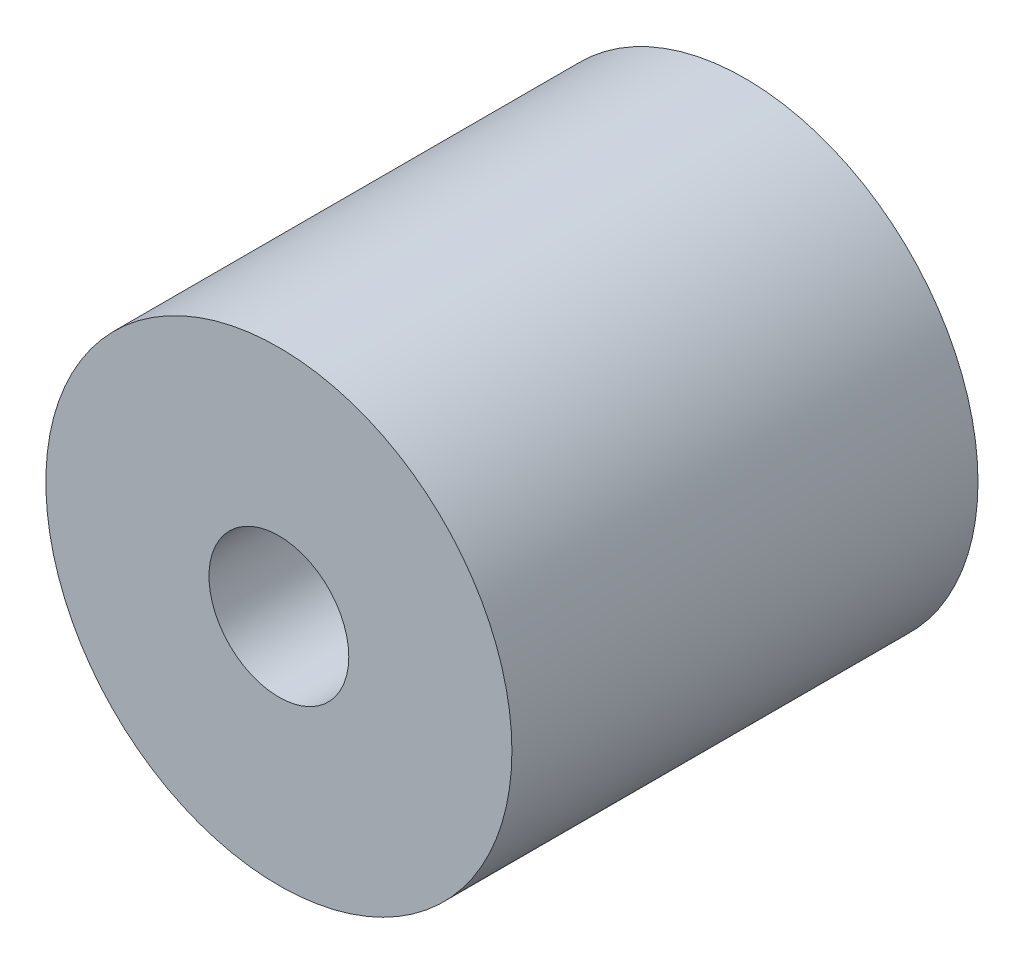
from build123d import *

# Parameters (mm, degrees)
SKETCH1_R           = 5
SKETCH1_R_2         = 1.5
BOSS_EXTRUDE1_DEPTH = 10


with BuildPart() as part:
    # Sketch1 → Boss-Extrude1 (new body)
    with BuildSketch(Plane.XY):
        Circle(SKETCH1_R)
        Circle(SKETCH1_R_2, mode=Mode.SUBTRACT)
    extrude(amount=BOSS_EXTRUDE1_DEPTH)


solid = part.part
